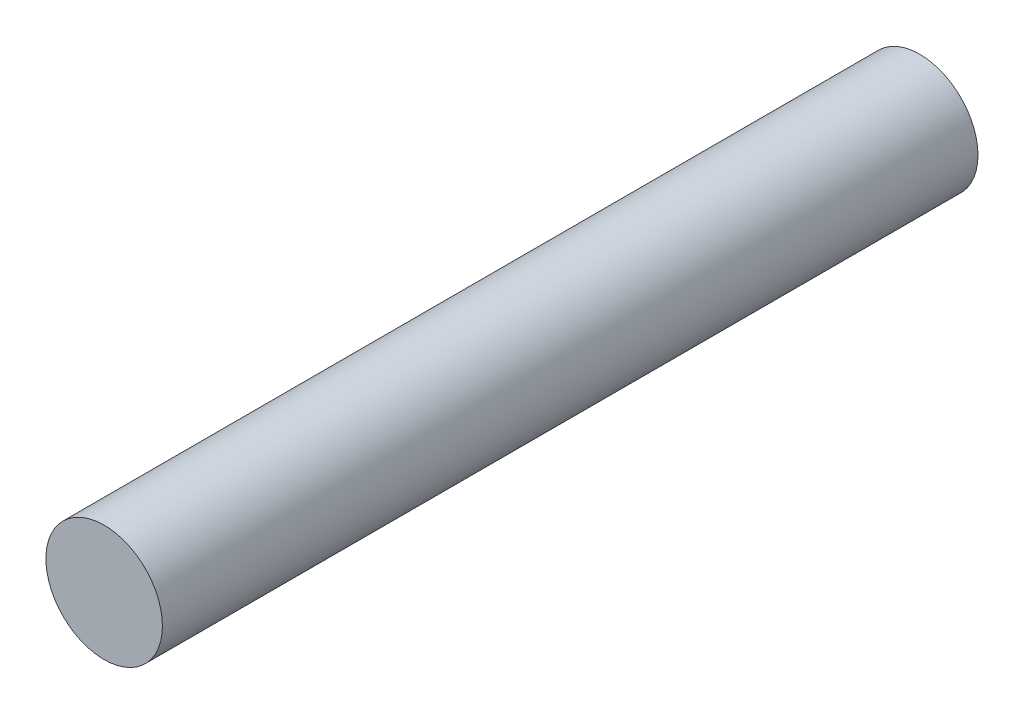
from build123d import *

# Parameters (mm, degrees)
SKETCH_1_R      = 2.5
EXTRUDE_1_DEPTH = 35


with BuildPart() as part:
    # 草图1 → 凸台-拉伸1 (new body)
    with BuildSketch(Plane.XY):
        Circle(SKETCH_1_R)
    extrude(amount=EXTRUDE_1_DEPTH)


solid = part.part
